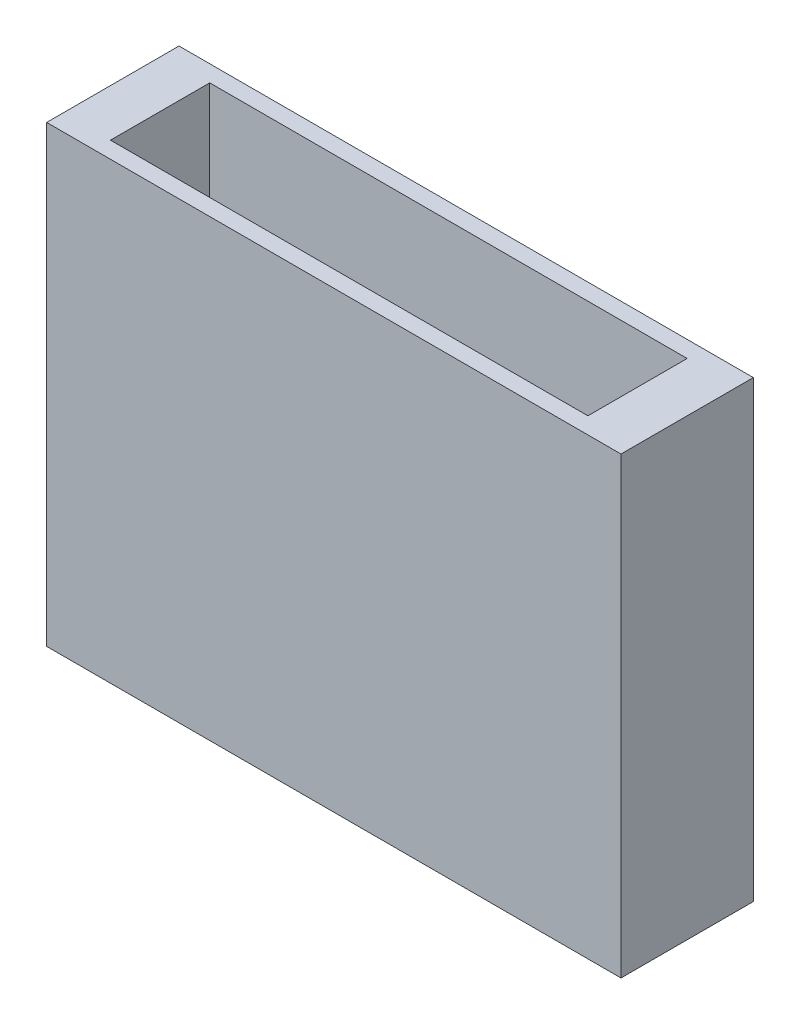
from build123d import *

# Parameters (mm, degrees)
CROQUIS1_W              = 24.3
CROQUIS1_H              = 19.2
SALIENTE_EXTRUIR1_DEPTH = 5.6
CROQUIS2_W              = 20.2
CROQUIS2_H              = 4.2
CORTAR_EXTRUIR1_DEPTH   = 18
CROQUIS3_W              = 5
CROQUIS3_H              = 6.2
CORTAR_EXTRUIR2_DEPTH   = 2
CROQUIS5_W              = 18
CROQUIS5_H              = 14
CROQUIS5_W_2            = 5
CROQUIS5_H_2            = 6.2
SALIENTE_EXTRUIR3_DEPTH = 2
REDONDEO1_R             = 1


with BuildPart() as part:
    # Croquis1 → Saliente-Extruir1 (new body)
    with BuildSketch(Plane.XY):
        with Locations((12.15, 9.6)):
            Rectangle(CROQUIS1_W, CROQUIS1_H)
    extrude(amount=SALIENTE_EXTRUIR1_DEPTH)

    # Croquis2 → Cortar-Extruir1 (cut)
    with BuildSketch(Plane(origin=(0, 19.2, 0), x_dir=(1, 0, 0), z_dir=(0, 1, 0))):
        with Locations((12.1, -2.8)):
            Rectangle(CROQUIS2_W, CROQUIS2_H)
    extrude(amount=-CORTAR_EXTRUIR1_DEPTH, mode=Mode.SUBTRACT)

    # Croquis3 → Cortar-Extruir2 (cut)
    with BuildSketch(Plane(origin=(0, 0, 0), x_dir=(-1, 0, 0), z_dir=(0, 0, -1))):
        with Locations((-12.15, 9.9)):
            Rectangle(CROQUIS3_W, CROQUIS3_H)
    extrude(amount=-CORTAR_EXTRUIR2_DEPTH, mode=Mode.SUBTRACT)

    # Croquis5 → Saliente-Extruir3 (add)
    with BuildSketch(Plane(origin=(0, 0, 0), x_dir=(-1, 0, 0), z_dir=(0, 0, -1))):
        with Locations((-12.042477661, 9.840107479)):
            Rectangle(CROQUIS5_W, CROQUIS5_H)
        with Locations((-12.15, 9.9)):
            Rectangle(CROQUIS5_W_2, CROQUIS5_H_2, mode=Mode.SUBTRACT)
    extrude(amount=SALIENTE_EXTRUIR3_DEPTH)

    # Redondeo1
    redondeo1_edges = [part.edges().sort_by_distance(p)[0] for p in [
        (21.042477661, 9.840107479, -2),
        (12.042477661, 2.840107479, -2),
        (3.042477661, 9.840107479, -2),
        (12.042477661, 16.840107479, -2),
        (14.65, 9.9, -2),
        (12.15, 6.8, -2),
        (9.65, 9.9, -2),
        (12.15, 13, -2),
    ]]
    fillet(redondeo1_edges, radius=REDONDEO1_R)


solid = part.part
